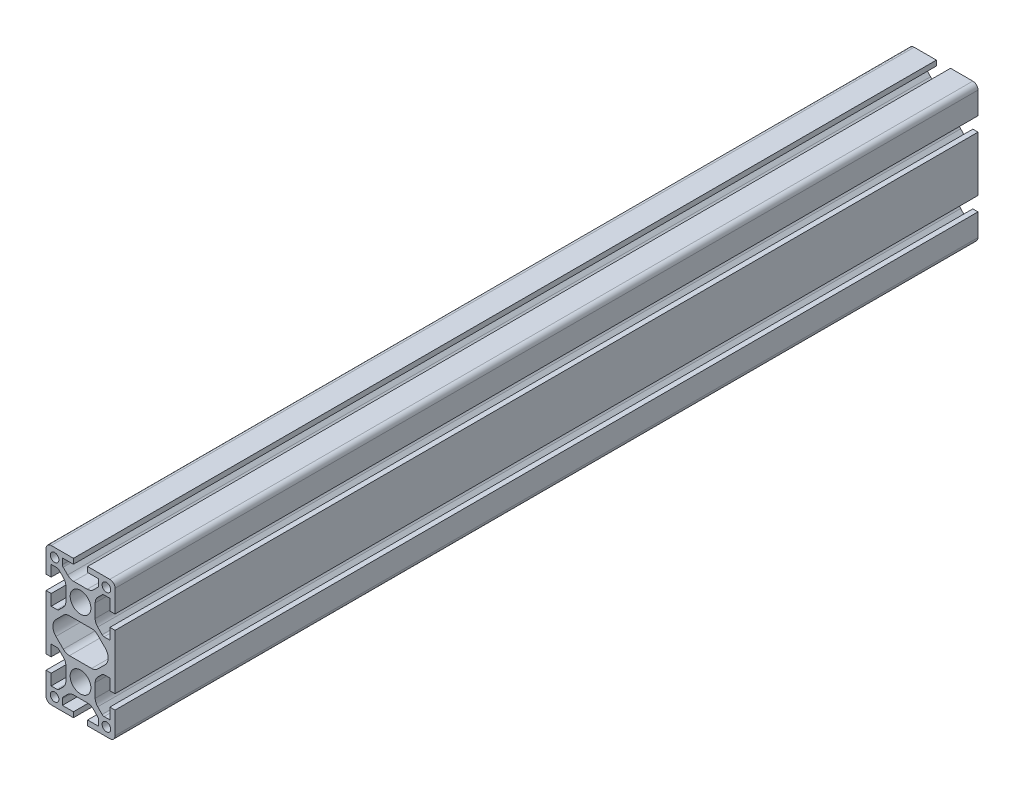
from build123d import *

# Parameters (mm, degrees)
SKETCH1_R           = 2.5
SKETCH1_R_2         = 6
BOSS_EXTRUDE1_DEPTH = 500


with BuildPart() as part:
    # Sketch1 → Boss-Extrude1 (new body)
    with BuildSketch(Plane.XY):
        with BuildLine():
            Line((-17, -40), (-4.1, -40))
            Line((-4.1, -40), (-4.1, -37))
            Line((-4.1, -37), (-10.5, -37))
            Line((-10.5, -37), (-10.5, -33.6627417))
            ThreePointArc((-10.5, -33.6627417), (-10.378207252, -33.050448208), (-10.03137085, -32.53137085))
            Line((-10.03137085, -32.53137085), (-7.464466094, -29.964466094))
            ThreePointArc((-7.464466094, -29.964466094), (-5.84234935, -28.880602337), (-3.928932188, -28.5))
            Line((-3.928932188, -28.5), (3.928932188, -28.5))
            ThreePointArc((3.928932188, -28.5), (5.84234935, -28.880602337), (7.464466094, -29.964466094))
            Line((7.464466094, -29.964466094), (10.03137085, -32.53137085))
            ThreePointArc((10.03137085, -32.53137085), (10.378207252, -33.050448208), (10.5, -33.6627417))
            Line((10.5, -33.6627417), (10.5, -37))
            Line((10.5, -37), (4.1, -37))
            Line((4.1, -37), (4.1, -40))
            Line((4.1, -40), (17, -40))
            ThreePointArc((17, -40), (19.121320344, -39.121320344), (20, -37))
            Line((20, -37), (20, -24.1))
            Line((20, -24.1), (17, -24.1))
            Line((17, -24.1), (17, -30.5))
            Line((17, -30.5), (13.6627417, -30.5))
            ThreePointArc((13.6627417, -30.5), (13.050448208, -30.378207252), (12.53137085, -30.03137085))
            Line((12.53137085, -30.03137085), (9.964466094, -27.464466094))
            ThreePointArc((9.964466094, -27.464466094), (8.880602337, -25.84234935), (8.5, -23.928932188))
            Line((8.5, -23.928932188), (8.5, -16.071067812))
            ThreePointArc((8.5, -16.071067812), (8.880602337, -14.15765065), (9.964466094, -12.535533906))
            Line((9.964466094, -12.535533906), (12.53137085, -9.96862915))
            ThreePointArc((12.53137085, -9.96862915), (13.050448208, -9.621792748), (13.6627417, -9.5))
            Line((13.6627417, -9.5), (17, -9.5))
            Line((17, -9.5), (17, -15.9))
            Line((17, -15.9), (20, -15.9))
            Line((20, -15.9), (20, 15.9))
            Line((20, 15.9), (17, 15.9))
            Line((17, 15.9), (17, 9.5))
            Line((17, 9.5), (13.6627417, 9.5))
            ThreePointArc((13.6627417, 9.5), (13.050448208, 9.621792748), (12.53137085, 9.96862915))
            Line((12.53137085, 9.96862915), (9.964466094, 12.535533906))
            ThreePointArc((9.964466094, 12.535533906), (8.880602337, 14.15765065), (8.5, 16.071067812))
            Line((8.5, 16.071067812), (8.5, 23.928932188))
            ThreePointArc((8.5, 23.928932188), (8.880602337, 25.84234935), (9.964466094, 27.464466094))
            Line((9.964466094, 27.464466094), (12.53137085, 30.03137085))
            ThreePointArc((12.53137085, 30.03137085), (13.050448208, 30.378207252), (13.6627417, 30.5))
            Line((13.6627417, 30.5), (17, 30.5))
            Line((17, 30.5), (17, 24.1))
            Line((17, 24.1), (20, 24.1))
            Line((20, 24.1), (20, 37))
            ThreePointArc((20, 37), (19.121320344, 39.121320344), (17, 40))
            Line((17, 40), (4.1, 40))
            Line((4.1, 40), (4.1, 37))
            Line((4.1, 37), (10.5, 37))
            Line((10.5, 37), (10.5, 33.6627417))
            ThreePointArc((10.5, 33.6627417), (10.378207252, 33.050448208), (10.03137085, 32.53137085))
            Line((10.03137085, 32.53137085), (7.464466094, 29.964466094))
            ThreePointArc((7.464466094, 29.964466094), (5.84234935, 28.880602337), (3.928932188, 28.5))
            Line((3.928932188, 28.5), (-3.928932188, 28.5))
            ThreePointArc((-3.928932188, 28.5), (-5.84234935, 28.880602337), (-7.464466094, 29.964466094))
            Line((-7.464466094, 29.964466094), (-10.03137085, 32.53137085))
            ThreePointArc((-10.03137085, 32.53137085), (-10.378207252, 33.050448208), (-10.5, 33.6627417))
            Line((-10.5, 33.6627417), (-10.5, 37))
            Line((-10.5, 37), (-4.1, 37))
            Line((-4.1, 37), (-4.1, 40))
            Line((-4.1, 40), (-17, 40))
            ThreePointArc((-17, 40), (-19.121320344, 39.121320344), (-20, 37))
            Line((-20, 37), (-20, 24.1))
            Line((-20, 24.1), (-17, 24.1))
            Line((-17, 24.1), (-17, 30.5))
            Line((-17, 30.5), (-13.6627417, 30.5))
            ThreePointArc((-13.6627417, 30.5), (-13.050448208, 30.378207252), (-12.53137085, 30.03137085))
            Line((-12.53137085, 30.03137085), (-9.964466094, 27.464466094))
            ThreePointArc((-9.964466094, 27.464466094), (-8.880602337, 25.84234935), (-8.5, 23.928932188))
            Line((-8.5, 23.928932188), (-8.5, 16.071067812))
            ThreePointArc((-8.5, 16.071067812), (-8.880602337, 14.15765065), (-9.964466094, 12.535533906))
            Line((-9.964466094, 12.535533906), (-12.53137085, 9.96862915))
            ThreePointArc((-12.53137085, 9.96862915), (-13.050448208, 9.621792748), (-13.6627417, 9.5))
            Line((-13.6627417, 9.5), (-17, 9.5))
            Line((-17, 9.5), (-17, 15.9))
            Line((-17, 15.9), (-20, 15.9))
            Line((-20, 15.9), (-20, -15.9))
            Line((-20, -15.9), (-17, -15.9))
            Line((-17, -15.9), (-17, -9.5))
            Line((-17, -9.5), (-13.6627417, -9.5))
            ThreePointArc((-13.6627417, -9.5), (-13.050448208, -9.621792748), (-12.53137085, -9.96862915))
            Line((-12.53137085, -9.96862915), (-9.964466094, -12.535533906))
            ThreePointArc((-9.964466094, -12.535533906), (-8.880602337, -14.15765065), (-8.5, -16.071067812))
            Line((-8.5, -16.071067812), (-8.5, -23.928932188))
            ThreePointArc((-8.5, -23.928932188), (-8.880602337, -25.84234935), (-9.964466094, -27.464466094))
            Line((-9.964466094, -27.464466094), (-12.53137085, -30.03137085))
            ThreePointArc((-12.53137085, -30.03137085), (-13.050448208, -30.378207252), (-13.6627417, -30.5))
            Line((-13.6627417, -30.5), (-17, -30.5))
            Line((-17, -30.5), (-17, -24.1))
            Line((-17, -24.1), (-20, -24.1))
            Line((-20, -24.1), (-20, -37))
            ThreePointArc((-20, -37), (-19.121320344, -39.121320344), (-17, -40))
        make_face()
        with Locations((15, 35)):
            Circle(SKETCH1_R, mode=Mode.SUBTRACT)
        with Locations((15, -35)):
            Circle(SKETCH1_R, mode=Mode.SUBTRACT)
        with Locations((0, 20)):
            Circle(SKETCH1_R_2, mode=Mode.SUBTRACT)
        with Locations((0, -20)):
            Circle(SKETCH1_R_2, mode=Mode.SUBTRACT)
        with Locations((-15, 35)):
            Circle(SKETCH1_R, mode=Mode.SUBTRACT)
        with Locations((-15, -35)):
            Circle(SKETCH1_R, mode=Mode.SUBTRACT)
        with BuildLine():
            Line((-14.242640687, -4.242640687), (-9.949747468, -8.535533906))
            ThreePointArc((-9.949747468, -8.535533906), (-8.327630724, -9.619397663), (-6.414213562, -10))
            Line((-6.414213562, -10), (6.414213562, -10))
            ThreePointArc((6.414213562, -10), (8.327630724, -9.619397663), (9.949747468, -8.535533906))
            Line((9.949747468, -8.535533906), (14.242640687, -4.242640687))
            ThreePointArc((14.242640687, -4.242640687), (16, 0), (14.242640687, 4.242640687))
            Line((14.242640687, 4.242640687), (9.949747468, 8.535533906))
            ThreePointArc((9.949747468, 8.535533906), (8.327630724, 9.619397663), (6.414213562, 10))
            Line((6.414213562, 10), (-6.414213562, 10))
            ThreePointArc((-6.414213562, 10), (-8.327630724, 9.619397663), (-9.949747468, 8.535533906))
            Line((-9.949747468, 8.535533906), (-14.242640687, 4.242640687))
            ThreePointArc((-14.242640687, 4.242640687), (-16, 0), (-14.242640687, -4.242640687))
        make_face(mode=Mode.SUBTRACT)
    extrude(amount=-BOSS_EXTRUDE1_DEPTH)


solid = part.part
